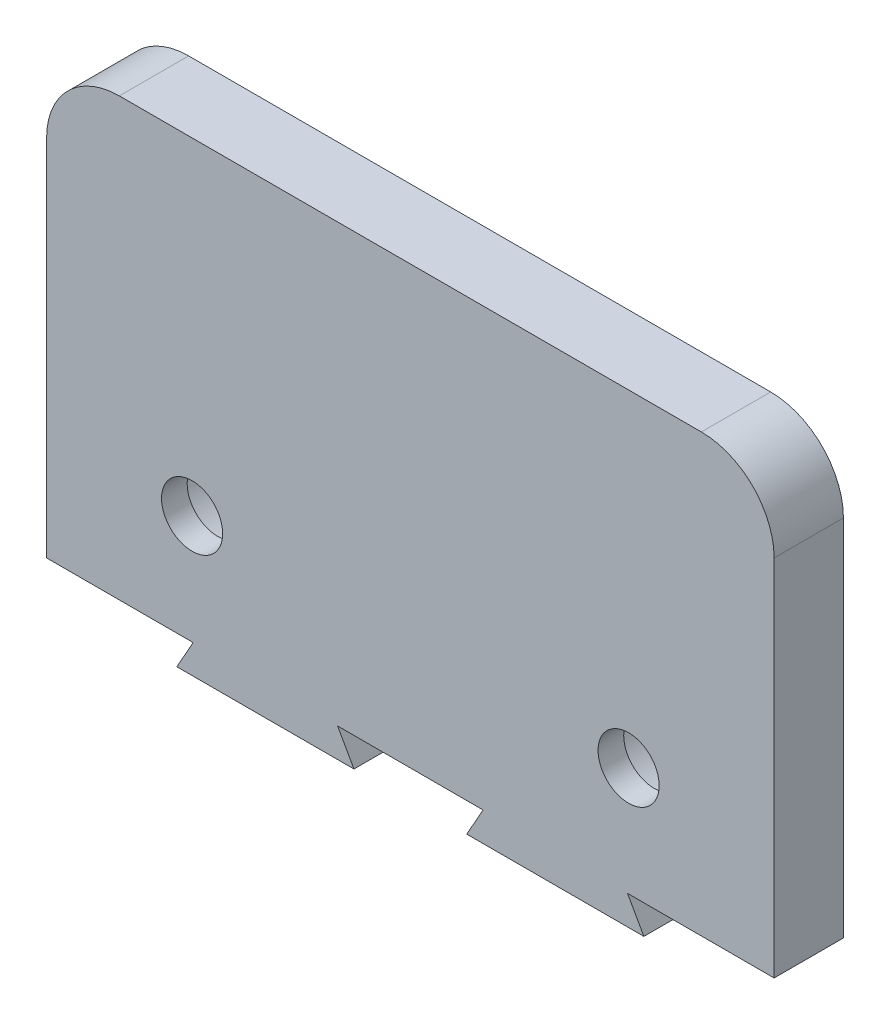
from build123d import *

# Parameters (mm, degrees)
ESBO_O1_W                                    = 100
ESBO_O1_H                                    = 9.525
RESSALTO_EXTRUS_O1_DEPTH                     = 60
RESSALTO_EXTRUS_O2_DEPTH                     = 4.7625
FILETE1_R                                    = 10
ESBO_O3_R                                    = 4
CORTE_EXTRUS_O1_DEPTH                        = 79.68116436
REBAIXO_PARA_PARAFUSO_COM_CABE_A_PAN_2_COUNT = 2
REBAIXO_PARA_PARAFUSO_COM_CABE_A_PAN_2_PITCH = 60


with BuildPart() as part:
    # Esboço1 → Ressalto-extrusão1 (new body)
    with BuildSketch(Plane(origin=(0, 0, 0), x_dir=(1, 0, 0), z_dir=(0, 1, 0))):
        Rectangle(ESBO_O1_W, ESBO_O1_H)
    extrude(amount=RESSALTO_EXTRUS_O1_DEPTH)

    # Esboço2 → Ressalto-extrusão2 (add, symmetric)
    with BuildSketch(Plane.XY):
        Polygon((-29.85, 0), (-10, 0), (-7.75, -4), (-32.1, -4), align=None)
    ressalto_extrus_o2 = extrude(amount=RESSALTO_EXTRUS_O2_DEPTH, both=True)

    # Espelhar1: Ressalto-extrusão2 across plane
    add(ressalto_extrus_o2.mirror(Plane(origin=(0, 0, 0), x_dir=(0, 0, 1), z_dir=(1, 0, 0))))

    # Filete1
    filete1_edges = [part.edges().sort_by_distance(p)[0] for p in [
        (50, 60, 0),
        (-50, 60, 0),
    ]]
    fillet(filete1_edges, radius=FILETE1_R)

    # Esboço3 → Corte-extrusão1 (cut, through all)
    with BuildSketch(Plane.XY.offset(4.7625)):
        with Locations((-30, 15)):
            Circle(ESBO_O3_R)
        with Locations((30, 15)):
            Circle(ESBO_O3_R)
    extrude(amount=-CORTE_EXTRUS_O1_DEPTH, mode=Mode.SUBTRACT)

    # Esboço9 → Rebaixo para parafuso com cabeça panela de M82 (revolve, cut)
    with BuildSketch(Plane(origin=(30, 15, -4.7625), x_dir=(0, 1, 0), z_dir=(1, 0, 0))):
        Polygon((0, 0), (0, 22.5736146), (4.2, 20.05), (4.2, 6), (9, 6), (9, 0.025), (9.025, 0), align=None)
    rebaixo_para_parafuso_com_cabe_a_panela = revolve(axis=Axis((30, 15, -11.1125), (0, 0, 1)), mode=Mode.SUBTRACT)

    # Rebaixo para parafuso com cabe_a pan 2: Rebaixo para parafuso com cabeça panela de M82 ×2
    with Locations(*[(-i * REBAIXO_PARA_PARAFUSO_COM_CABE_A_PAN_2_PITCH, 0, 0) for i in range(1, REBAIXO_PARA_PARAFUSO_COM_CABE_A_PAN_2_COUNT)]):
        add(rebaixo_para_parafuso_com_cabe_a_panela, mode=Mode.SUBTRACT)


solid = part.part
